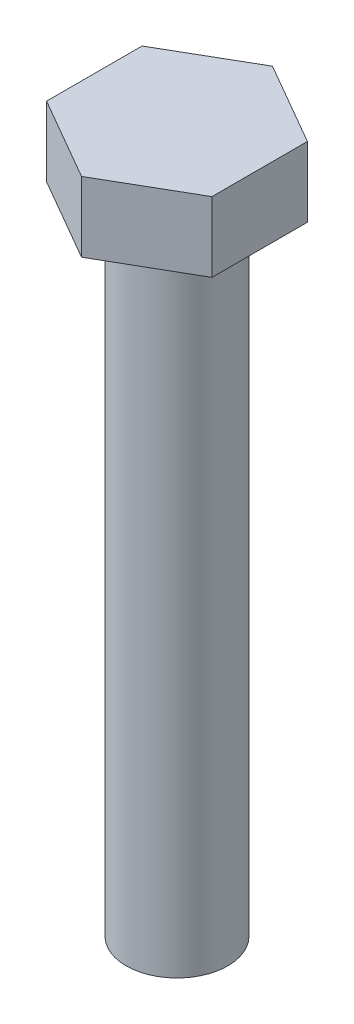
from build123d import *

# Parameters (mm, degrees)
BOSS_EXTRU_1_DEPTH = 5.5
ESQUISSE2_R        = 4
BOSS_EXTRU_2_DEPTH = 50


with BuildPart() as part:
    # Esquisse1 → Boss.-Extru.1 (new body)
    with BuildSketch(Plane(origin=(0, 0, 0), x_dir=(1, 0, 0), z_dir=(0, 1, 0))):
        Polygon((6.5, 3.75277675), (0, 7.505553499), (-6.5, 3.75277675), (-6.5, -3.75277675), (0, -7.505553499), (6.5, -3.75277675), align=None)
    extrude(amount=BOSS_EXTRU_1_DEPTH)

    # Esquisse2 → Boss.-Extru.2 (add)
    with BuildSketch(Plane(origin=(0, 0, 0), x_dir=(1, 0, 0), z_dir=(0, 1, 0))):
        with Locations(Location((0, 0, 0), (0, 0, 270))):
            Circle(ESQUISSE2_R)
    extrude(amount=-BOSS_EXTRU_2_DEPTH)


solid = part.part
